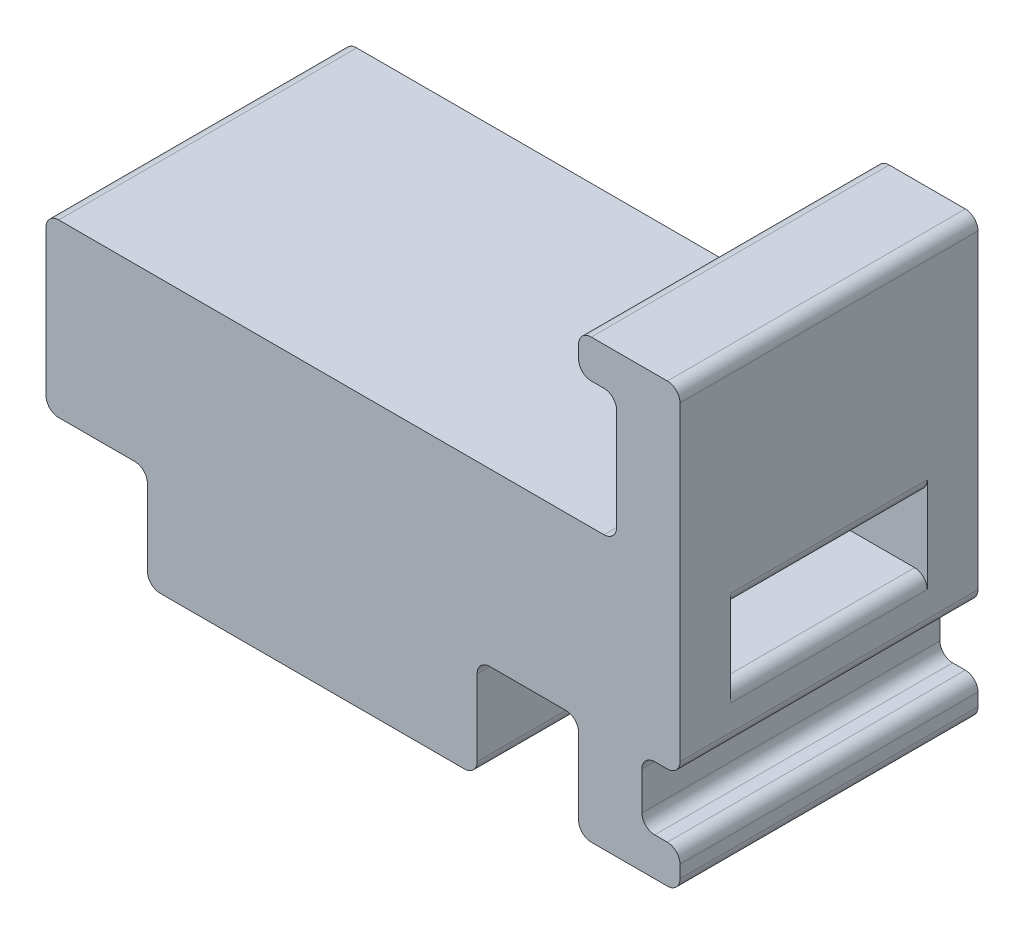
from build123d import *

# Parameters (mm, degrees)
BOSS_EXTRUDE2_DEPTH = 11.75
SKETCH5_W           = 15.5
SKETCH5_H           = 5.5
CUT_EXTRUDE2_DEPTH  = 56.302011717
FILLET1_R           = 1
SKETCH7_R           = 10.25
CUT_EXTRUDE3_DEPTH  = 7.5


with BuildPart() as part:
    # Sketch1 → Boss-Extrude2 (new, symmetric)
    with BuildSketch(Plane.XY):
        with BuildLine():
            Line((-25, 6.5), (-25, -5))
            ThreePointArc((-25, -5), (-24.707106781, -5.707106781), (-24, -6))
            Line((-24, -6), (-18, -6))
            ThreePointArc((-18, -6), (-17.292893219, -6.292893219), (-17, -7))
            Line((-17, -7), (-17, -13))
            ThreePointArc((-17, -13), (-16.707106781, -13.707106781), (-16, -14))
            Line((-16, -14), (-4, -14))
            Line((-4, -14), (8, -14))
            ThreePointArc((8, -14), (8.707106781, -13.707106781), (9, -13))
            Line((9, -13), (9, -7))
            ThreePointArc((9, -7), (9.292893219, -6.292893219), (10, -6))
            Line((10, -6), (16, -6))
            ThreePointArc((16, -6), (16.707106781, -6.292893219), (17, -7))
            Line((17, -7), (17, -11))
            Line((17, -11), (17, -13))
            ThreePointArc((17, -13), (17.292893219, -13.707106781), (18, -14))
            Line((18, -14), (24, -14))
            ThreePointArc((24, -14), (24.707106781, -13.707106781), (25, -13))
            Line((25, -13), (25, -12))
            ThreePointArc((25, -12), (24.707106781, -11.292893219), (24, -11))
            Line((24, -11), (23, -11))
            ThreePointArc((23, -11), (22.292893219, -10.707106781), (22, -10))
            Line((22, -10), (22, -7))
            ThreePointArc((22, -7), (22.292893219, -6.292893219), (23, -6))
            Line((23, -6), (24, -6))
            ThreePointArc((24, -6), (24.707106781, -5.707106781), (25, -5))
            Line((25, -5), (25, 8.5))
            Line((25, 8.5), (25, 16))
            Line((25, 16), (25, 19.5))
            ThreePointArc((25, 19.5), (24.707106781, 20.207106781), (24, 20.5))
            Line((24, 20.5), (18, 20.5))
            ThreePointArc((18, 20.5), (17.292893219, 20.207106781), (17, 19.5))
            Line((17, 19.5), (17, 18.5))
            ThreePointArc((17, 18.5), (17.292893219, 17.792893219), (18, 17.5))
            Line((18, 17.5), (19, 17.5))
            ThreePointArc((19, 17.5), (19.707106781, 17.207106781), (20, 16.5))
            Line((20, 16.5), (20, 8.5))
            ThreePointArc((20, 8.5), (19.707106781, 7.792893219), (19, 7.5))
            Line((19, 7.5), (-24, 7.5))
            ThreePointArc((-24, 7.5), (-24.707106781, 7.207106781), (-25, 6.5))
        make_face()
    extrude(amount=BOSS_EXTRUDE2_DEPTH, both=True)

    # Sketch5 → Cut-Extrude2 (cut, through all)
    with BuildSketch(Plane.ZY.offset(25)):
        with Locations((0, 0.75)):
            Rectangle(SKETCH5_W, SKETCH5_H)
    extrude(amount=-CUT_EXTRUDE2_DEPTH, mode=Mode.SUBTRACT)

    # Fillet1
    fillet1_edges = [part.edges().sort_by_distance(p)[0] for p in [
        (-25, 3.5, 0),
        (25, -2, 0),
        (25, 3.5, 0),
        (-25, -2, 0),
    ]]
    fillet(fillet1_edges, radius=FILLET1_R)

    # Sketch7 → Cut-Extrude3 (cut, symmetric)
    with BuildSketch(Plane.XZ.offset(14)):
        with Locations(Location((-4, 0, 0), (0, 0, 270))):
            Circle(SKETCH7_R)
    extrude(amount=CUT_EXTRUDE3_DEPTH, both=True, mode=Mode.SUBTRACT)


solid = part.part
